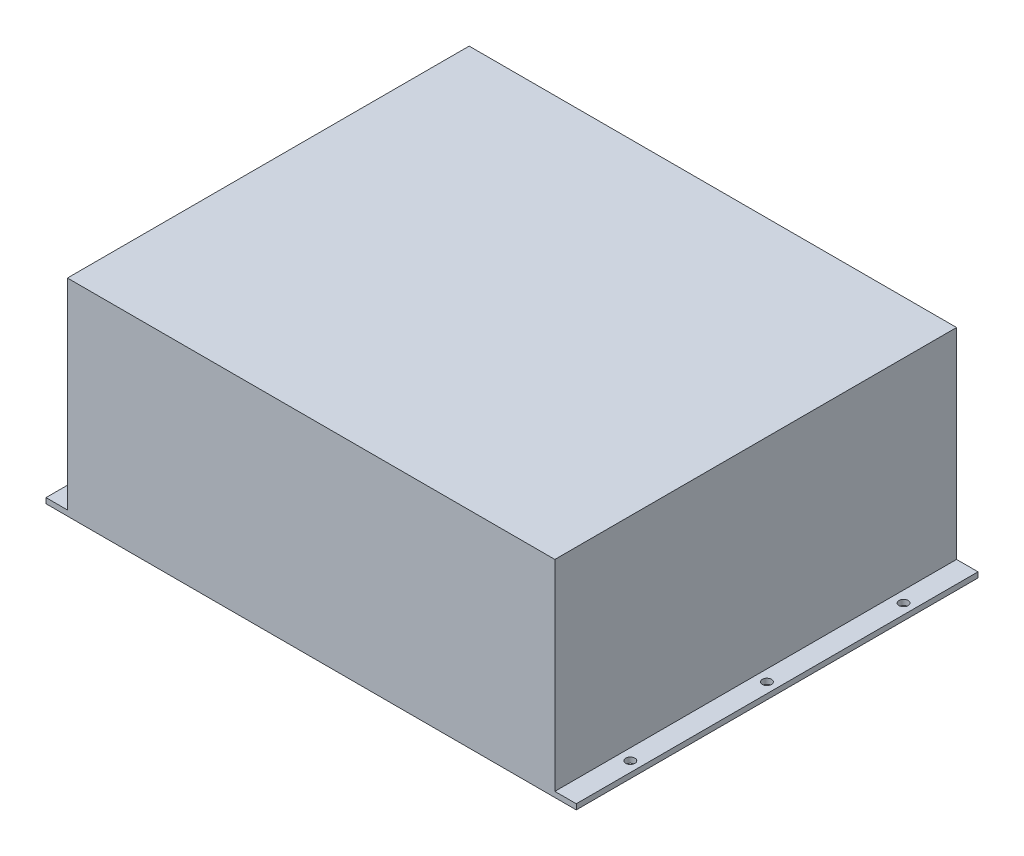
from build123d import *

# Parameters (mm, degrees)
SKETCH_1_W          = 182
SKETCH_1_H          = 150
EXTRUDE_1_DEPTH     = 77
SKETCH_2_W          = 8
SKETCH_2_H          = 150
EXTRUDE_2_DEPTH     = 2
SKETCH_3_R          = 1.7
CUT_EXTRUDE_1_DEPTH = 146.089627472
SKETCH_4_R          = 4
EXTRUDE_3_DEPTH     = 10


with BuildPart() as part:
    # 草图1 → 凸台-拉伸1 (new body)
    with BuildSketch(Plane(origin=(0, 0, 0), x_dir=(1, 0, 0), z_dir=(0, 1, 0))):
        Rectangle(SKETCH_1_W, SKETCH_1_H)
    extrude(amount=EXTRUDE_1_DEPTH)

    # 草图2 → 凸台-拉伸2 (add)
    with BuildSketch(Plane.XZ):
        with Locations((-95, 0)):
            Rectangle(SKETCH_2_W, SKETCH_2_H)
    extrude_2 = extrude(amount=-EXTRUDE_2_DEPTH)

    # 草图3 → 切除-拉伸1 (cut, through all)
    with BuildSketch(Plane(origin=(0, 2, 0), x_dir=(1, 0, 0), z_dir=(0, 1, 0))):
        with Locations(Location((-95.2, 51, 0), (0, 0, 270))):
            Circle(SKETCH_3_R)
        with Locations(Location((-95.2, -51, 0), (0, 0, 90))):
            Circle(SKETCH_3_R)
        with Locations(Location((-95.2, 0, 0), (0, 0, 270))):
            Circle(SKETCH_3_R)
    cut_extrude_1 = extrude(amount=-CUT_EXTRUDE_1_DEPTH, mode=Mode.SUBTRACT)

    # 镜向1: 凸台-拉伸2, 切除-拉伸1 across plane
    add(extrude_2.mirror(Plane(origin=(0, 0, 0), x_dir=(0, 0, 1), z_dir=(1, 0, 0))))
    add(cut_extrude_1.mirror(Plane(origin=(0, 0, 0), x_dir=(0, 0, 1), z_dir=(1, 0, 0))), mode=Mode.SUBTRACT)

    # 草图4 → 凸台-拉伸3 (add)
    with BuildSketch(Plane.ZY.offset(91)):
        with Locations(Location((0, 39.5, 0), (0, 0, 180))):
            Circle(SKETCH_4_R)
        with Locations(Location((10, 39.5, 0), (0, 0, 180))):
            Circle(SKETCH_4_R)
        with Locations(Location((-10, 39.5, 0), (0, 0, 180))):
            Circle(SKETCH_4_R)
    extrude(amount=EXTRUDE_3_DEPTH)


solid = part.part
